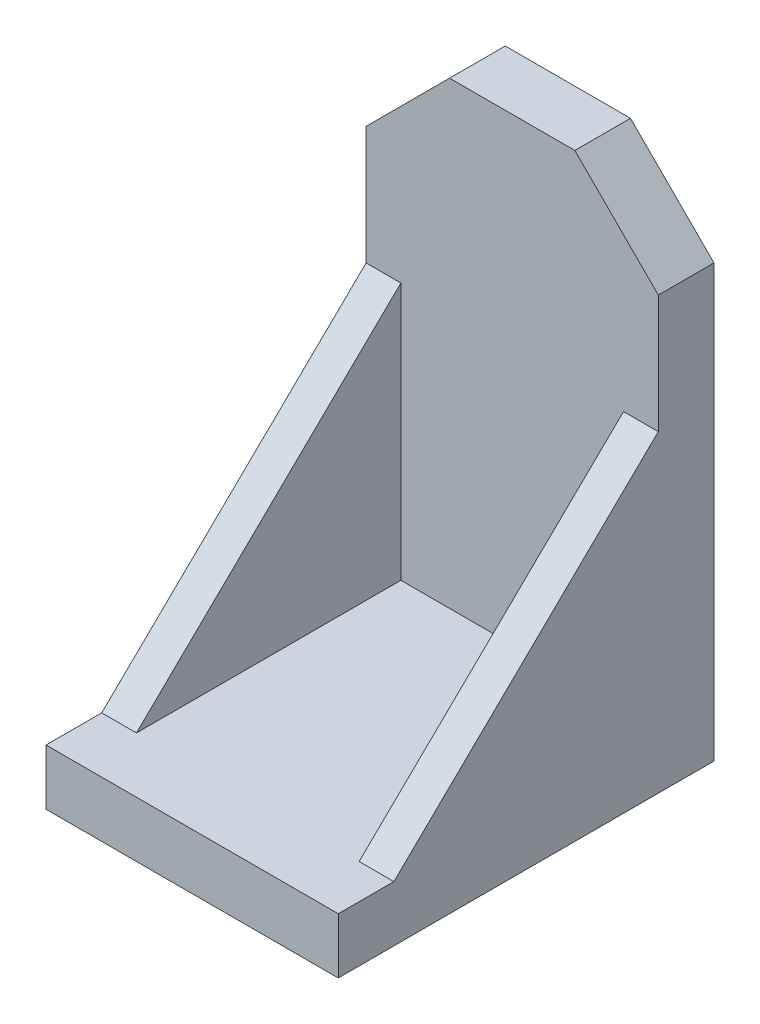
from build123d import *

# Parameters (mm, degrees)
BOSS_EXTRUDE1_DEPTH = 8
SKETCH2_W           = 42
SKETCH2_H           = 8
BOSS_EXTRUDE2_DEPTH = 46
BOSS_EXTRUDE3_DEPTH = 5


with BuildPart() as part:
    # Sketch1 → Boss-Extrude1 (new body)
    with BuildSketch(Plane.XY):
        Polygon((0, 0), (0, 62), (12, 74), (30, 74), (42, 62), (42, 0), align=None)
    extrude(amount=BOSS_EXTRUDE1_DEPTH)

    # Sketch2 → Boss-Extrude2 (add)
    with BuildSketch(Plane.XY.offset(8)):
        with Locations((21, 4)):
            Rectangle(SKETCH2_W, SKETCH2_H)
    extrude(amount=BOSS_EXTRUDE2_DEPTH)

    # Sketch3 → Boss-Extrude3 (add)
    with BuildSketch(Plane(origin=(42, 0, 0), x_dir=(0, 0, -1), z_dir=(1, 0, 0))):
        Polygon((-8, 8), (-8, 45), (-46, 8), align=None)
    extrude(amount=-BOSS_EXTRUDE3_DEPTH)

    # Mirror1: part across plane


with BuildPart() as part_1:
    add(part.part)
    add(part.part.mirror(Plane(origin=(21, 0, 0), x_dir=(0, 0, 1), z_dir=(1, 0, 0))))


solid = part_1.part
